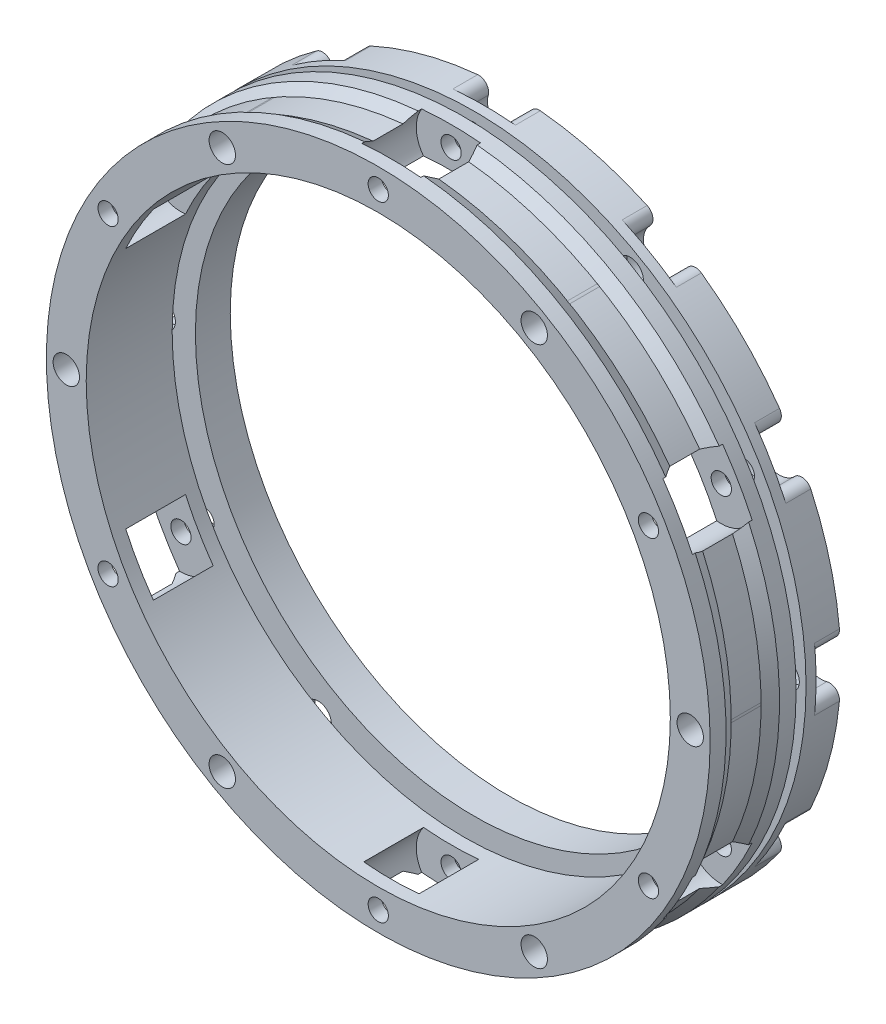
from build123d import *

# Parameters (mm, degrees)
SKETCH1_R                   = 100
SKETCH1_R_2                 = 88
CORE_STRUCTURE_DEPTH        = 25.9
SKETCH5_R                   = 100
SKETCH5_R_2                 = 84
HOVER_BRIM_DEPTH            = 10.5
SKETCH3_R                   = 10.5
BEARING_HOLE_DEPTH          = 9
SKETCH6_R                   = 3.05
BEARING_MOUNTING_HOLE_DEPTH = 146.796784944
SKETCH2_R                   = 3.9751
STRUCTURAL_HOLE_DEPTH       = 147.807220531
CIRPATTERN1_COUNT           = 6
SKETCH7_R                   = 6.5
CUT_EXTRUDE5_DEPTH          = 7.5
FILLET2_R                   = 3
CIRPATTERN13_COUNT          = 6
FILLET2_OF_CIRPATTERN13_R   = 3


with BuildPart() as part:
    # Sketch1 → Core Structure (new body)
    with BuildSketch(Plane.XY):
        with Locations(Location((0, 0, 0), (0, 0, 180))):
            Circle(SKETCH1_R)
        with Locations(Location((0, 0, 0), (0, 0, 180))):
            Circle(SKETCH1_R_2, mode=Mode.SUBTRACT)
    extrude(amount=CORE_STRUCTURE_DEPTH)

    # Sketch3 → Bearing Hole (cut, symmetric)
    with BuildSketch(Plane.XY.offset(12.95)):
        with Locations((0, 94)):
            Circle(SKETCH3_R)
    bearing_hole = extrude(amount=BEARING_HOLE_DEPTH, both=True, mode=Mode.SUBTRACT)


with BuildPart() as body_2:
    # Sketch5 → Hover Brim (new body)
    with BuildSketch(Plane.XY.offset(-3)):
        Circle(SKETCH5_R)
        Circle(SKETCH5_R_2, mode=Mode.SUBTRACT)
    extrude(amount=-HOVER_BRIM_DEPTH)


with BuildPart() as bearing_mounting_hole_tool:
    # Sketch6 → Bearing Mounting Hole (new, symmetric)
    with BuildSketch(Plane(origin=(0, 0, 21.95), x_dir=(-1, 0, 0), z_dir=(0, 0, -1))):
        with Locations((0, 94)):
            Circle(SKETCH6_R)
    bearing_mounting_hole = extrude(amount=BEARING_MOUNTING_HOLE_DEPTH, both=True)


with BuildPart() as part_1:
    add(part.part)

    # Bearing Mounting Hole: cut by bearing_mounting_hole_tool
    add(bearing_mounting_hole_tool.part, mode=Mode.SUBTRACT)


with BuildPart() as body_2_1:
    add(body_2.part)

    # Bearing Mounting Hole: cut by bearing_mounting_hole_tool
    add(bearing_mounting_hole_tool.part, mode=Mode.SUBTRACT)


with BuildPart() as structural_hole_tool:
    # Sketch2 → Structural Hole (new, symmetric)
    with BuildSketch(Plane.XY.offset(25.9)):
        with Locations((47, 81.406387956)):
            Circle(SKETCH2_R)
    structural_hole = extrude(amount=STRUCTURAL_HOLE_DEPTH, both=True)


with BuildPart() as part_2:
    add(part_1.part)

    # Structural Hole: cut by structural_hole_tool
    add(structural_hole_tool.part, mode=Mode.SUBTRACT)


with BuildPart() as body_2_2:
    add(body_2_1.part)

    # Structural Hole: cut by structural_hole_tool
    add(structural_hole_tool.part, mode=Mode.SUBTRACT)


with BuildPart() as cirpattern1_tool:
    # CirPattern1: Bearing Hole, Bearing Mounting Hole, Structural Hole ×6 about axis
    cirpattern1_axis = Axis((0, 0, 0), (0, 0, 1))
    add([bearing_hole.rotate(cirpattern1_axis, i * 360 / CIRPATTERN1_COUNT) for i in range(1, CIRPATTERN1_COUNT)])
    add([bearing_mounting_hole.rotate(cirpattern1_axis, i * 360 / CIRPATTERN1_COUNT) for i in range(1, CIRPATTERN1_COUNT)])
    add([structural_hole.rotate(cirpattern1_axis, i * 360 / CIRPATTERN1_COUNT) for i in range(1, CIRPATTERN1_COUNT)])


with BuildPart() as part_3:
    add(part_2.part)

    # CirPattern1: cut by cirpattern1_tool
    add(cirpattern1_tool.part, mode=Mode.SUBTRACT)

    # Sketch4 → Cut-Revolve1 (revolve, cut)
    with BuildSketch(Plane(origin=(0, 0, 0), x_dir=(1, 0, 0), z_dir=(0, 1, 0)), mode=Mode.PRIVATE) as cut_revolve1_sk:
        Polygon((-98, -17.55), (-98, -8.55), (-100, -5), (-100, -21.1), align=None)
    revolve(cut_revolve1_sk.sketch.rotate(Axis((0, 0, 0), (0, 0, 1)), 335.093894831), axis=Axis((0, 0, 0), (0, 0, 1)), mode=Mode.SUBTRACT)


with BuildPart() as body_2_3:
    add(body_2_2.part)

    # CirPattern1: cut by cirpattern1_tool
    add(cirpattern1_tool.part, mode=Mode.SUBTRACT)

    # Sketch7 → Cut-Extrude5 (cut)
    with BuildSketch(Plane(origin=(0, 0, -13.5), x_dir=(-1, 0, 0), z_dir=(0, 0, -1))):
        with Locations((-47, 81.406387956)):
            Circle(SKETCH7_R)
        with Locations((0, 94)):
            Circle(SKETCH7_R)
    cut_extrude5 = extrude(amount=-CUT_EXTRUDE5_DEPTH, mode=Mode.SUBTRACT)

    # Fillet2
    fillet2_edges = [body_2_3.edges().sort_by_distance(p)[0] for p in [
        (47.75047076, 87.86291904, -9.75),
        (52.216284559, 85.284580241, -9.75),
        (-2.578338799, 99.966755319, -9.75),
        (2.578338799, 99.966755319, -9.75),
    ]]
    fillet(fillet2_edges, radius=FILLET2_R)

    # CirPattern13: Cut-Extrude5 ×6 about axis
    cirpattern13_axis = Axis((0, 0, 0), (0, 0, 1))
    for i in range(1, CIRPATTERN13_COUNT):
        add(cut_extrude5.rotate(cirpattern13_axis, i * 360 / CIRPATTERN13_COUNT), mode=Mode.SUBTRACT)

    # Fillet2 of CirPattern13
    fillet2_of_cirpattern13_edges = [body_2_3.edges().sort_by_distance(p)[0] for p in [
        (-52.216284559, 85.284580241, -9.75),
        (-47.75047076, 87.86291904, -9.75),
        (-87.86291904, 47.75047076, -9.75),
        (-85.284580241, 52.216284559, -9.75),
        (-99.966755319, -2.578338799, -9.75),
        (-99.966755319, 2.578338799, -9.75),
        (-85.284580241, -52.216284559, -9.75),
        (-87.86291904, -47.75047076, -9.75),
        (-47.75047076, -87.86291904, -9.75),
        (-52.216284559, -85.284580241, -9.75),
        (2.578338799, -99.966755319, -9.75),
        (-2.578338799, -99.966755319, -9.75),
        (52.216284559, -85.284580241, -9.75),
        (47.75047076, -87.86291904, -9.75),
        (87.86291904, -47.75047076, -9.75),
        (85.284580241, -52.216284559, -9.75),
        (99.966755319, 2.578338799, -9.75),
        (99.966755319, -2.578338799, -9.75),
        (85.284580241, 52.216284559, -9.75),
        (87.86291904, 47.75047076, -9.75),
    ]]
    fillet(fillet2_of_cirpattern13_edges, radius=FILLET2_OF_CIRPATTERN13_R)


solid = Compound([part_3.part, body_2_3.part])
